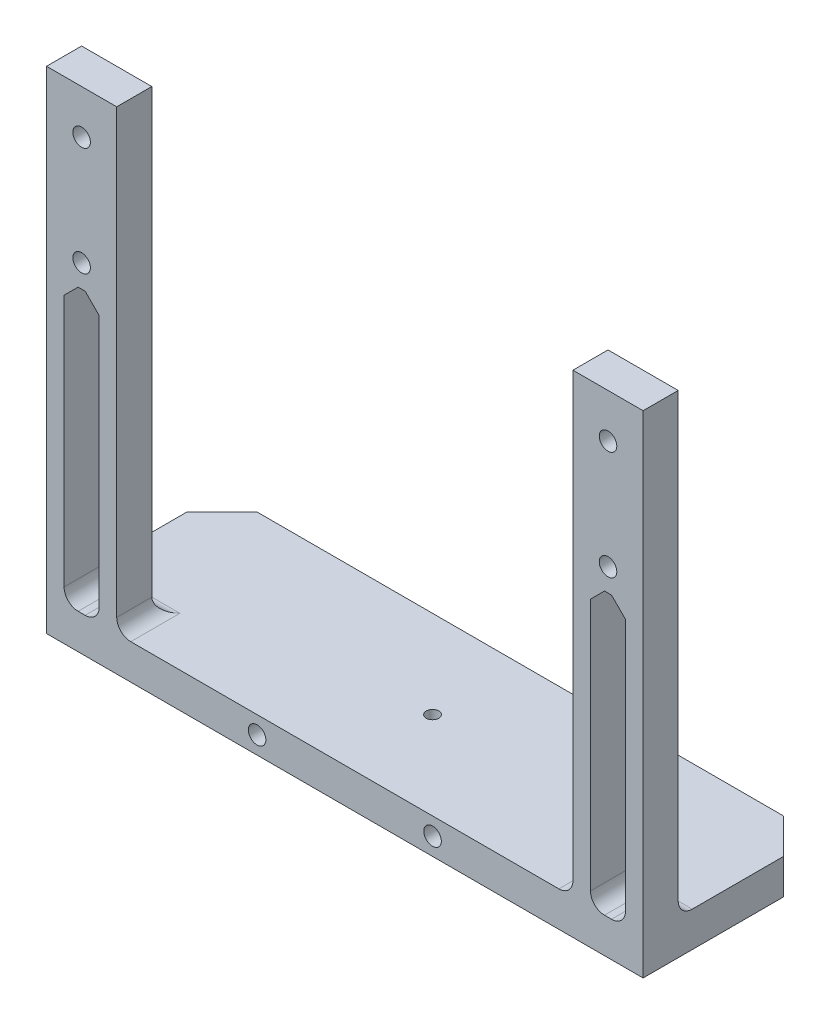
from build123d import *

# Parameters (mm, degrees)
SKETCH1_R           = 1.25
BOSS_EXTRUDE1_DEPTH = 5
SKETCH2_W           = 85
SKETCH2_H           = 5
BOSS_EXTRUDE2_DEPTH = 20
FILLET1_R           = 2
CUT_EXTRUDE1_DEPTH  = 25
SKETCH9_R           = 1.25
CUT_EXTRUDE2_DEPTH  = 58
SKETCH10_R          = 1.95
CUT_EXTRUDE3_DEPTH  = 2.9
SKETCH11_R          = 0.9
CUT_EXTRUDE4_DEPTH  = 6.9
CHAMFER1_SIZE       = 5


with BuildPart() as part:
    # Sketch1 → Boss-Extrude1 (new body)
    with BuildSketch(Plane.XY):
        Polygon((-32.5, 0), (32.5, 0), (32.5, 65), (42.5, 65), (42.5, 0), (42.5, -5), (-42.5, -5), (-42.5, 0), (-42.5, 65), (-32.5, 65), align=None)
        with Locations((37.5, 58.75)):
            Circle(SKETCH1_R, mode=Mode.SUBTRACT)
        with Locations((37.5, 43.25)):
            Circle(SKETCH1_R, mode=Mode.SUBTRACT)
        with Locations(Location((-37.5, 58.75, 0), (0, 0, 180))):
            Circle(SKETCH1_R, mode=Mode.SUBTRACT)
        with Locations(Location((-37.5, 43.25, 0), (0, 0, 180))):
            Circle(SKETCH1_R, mode=Mode.SUBTRACT)
    extrude(amount=BOSS_EXTRUDE1_DEPTH)

    # Sketch2 → Boss-Extrude2 (add)
    with BuildSketch(Plane(origin=(0, 0, 0), x_dir=(-1, 0, 0), z_dir=(0, 0, -1))):
        with Locations((0, -2.5)):
            Rectangle(SKETCH2_W, SKETCH2_H)
    extrude(amount=BOSS_EXTRUDE2_DEPTH)

    # Fillet1
    fillet1_edges = [part.edges().sort_by_distance(p)[0] for p in [
        (-37.5, 0, 0),
        (-32.5, 0, 2.5),
        (32.5, 0, 2.5),
        (37.5, 0, 0),
    ]]
    fillet(fillet1_edges, radius=FILLET1_R)

    # Sketch8 → Cut-Extrude1 (cut)
    with BuildSketch(Plane.XY.offset(5)):
        with BuildLine():
            Line((-38, 0), (-37, 0))
            ThreePointArc((-37, 0), (-35.585786438, 0.585786438), (-35, 2))
            Line((-35, 2), (-35, 38))
            Line((-35, 38), (-37, 40))
            Line((-37, 40), (-38, 40))
            Line((-38, 40), (-40, 38))
            Line((-40, 38), (-40, 2))
            ThreePointArc((-40, 2), (-39.414213562, 0.585786438), (-38, 0))
        make_face()
        with BuildLine():
            Line((38, 0), (37, 0))
            ThreePointArc((37, 0), (35.585786438, 0.585786438), (35, 2))
            Line((35, 2), (35, 38))
            Line((35, 38), (37, 40))
            Line((37, 40), (38, 40))
            Line((38, 40), (40, 38))
            Line((40, 38), (40, 2))
            ThreePointArc((40, 2), (39.414213562, 0.585786438), (38, 0))
        make_face()
    extrude(amount=-CUT_EXTRUDE1_DEPTH, mode=Mode.SUBTRACT)

    # Sketch9 → Cut-Extrude2 (cut)
    with BuildSketch(Plane(origin=(0, 0, -20), x_dir=(-1, 0, 0), z_dir=(0, 0, -1))):
        with Locations((12.5, -2.5)):
            Circle(SKETCH9_R)
        with Locations((-12.5, -2.5)):
            Circle(SKETCH9_R)
    extrude(amount=-CUT_EXTRUDE2_DEPTH, mode=Mode.SUBTRACT)

    # Sketch10 → Cut-Extrude3 (cut)
    with BuildSketch(Plane.XZ.offset(5)):
        with Locations(Location((0, -7.5, 0), (0, 0, 270))):
            Circle(SKETCH10_R)
    extrude(amount=-CUT_EXTRUDE3_DEPTH, mode=Mode.SUBTRACT)

    # Sketch11 → Cut-Extrude4 (cut)
    with BuildSketch(Plane.XZ.offset(2.1)):
        with Locations(Location((0, -7.5, 0), (0, 0, 270))):
            Circle(SKETCH11_R)
    extrude(amount=-CUT_EXTRUDE4_DEPTH, mode=Mode.SUBTRACT)

    # Chamfer1
    chamfer1_edges = [part.edges().sort_by_distance(p)[0] for p in [
        (-42.5, -2.5, -20),
        (42.5, -2.5, -20),
    ]]
    chamfer(chamfer1_edges, length=CHAMFER1_SIZE)


solid = part.part
